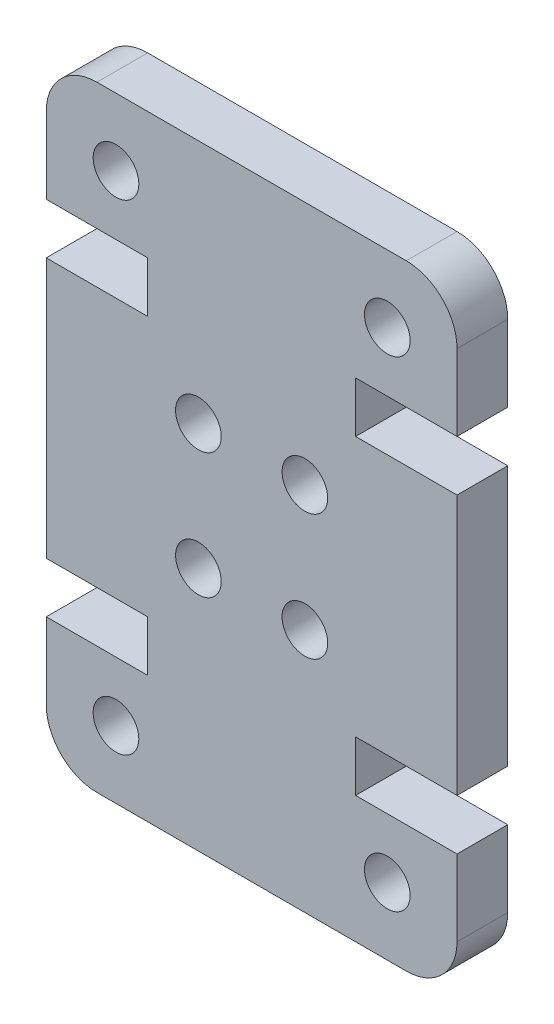
from build123d import *

# Parameters (mm, degrees)
SKETCH1_R           = 0.9
BOSS_EXTRUDE1_DEPTH = 2


with BuildPart() as part:
    # Sketch1 → Boss-Extrude1 (new body)
    with BuildSketch(Plane.XY):
        with BuildLine():
            Line((16.2, 17.26), (16.2, 7))
            Line((16.2, 7), (12.2, 7))
            Line((12.2, 7), (12.2, 5))
            Line((12.2, 5), (16.2, 5))
            Line((16.2, 5), (16.2, 2))
            ThreePointArc((16.2, 2), (15.614213562, 0.585786438), (14.2, 0))
            Line((14.2, 0), (2, 0))
            ThreePointArc((2, 0), (0.585786438, 0.585786438), (0, 2))
            Line((0, 2), (0, 5))
            Line((0, 5), (4, 5))
            Line((4, 5), (4, 7))
            Line((4, 7), (0, 7))
            Line((0, 7), (0, 17.26))
            Line((0, 17.26), (4, 17.26))
            Line((4, 17.26), (4, 19.26))
            Line((4, 19.26), (0, 19.26))
            Line((0, 19.26), (0, 22.26))
            ThreePointArc((0, 22.26), (0.585786438, 23.674213562), (2, 24.26))
            Line((2, 24.26), (14.2, 24.26))
            ThreePointArc((14.2, 24.26), (15.614213562, 23.674213562), (16.2, 22.26))
            Line((16.2, 22.26), (16.2, 19.26))
            Line((16.2, 19.26), (12.2, 19.26))
            Line((12.2, 19.26), (12.2, 17.26))
            Line((12.2, 17.26), (16.2, 17.26))
        make_face()
        with Locations(Location((13.45, 2.653551169, 0), (0, 0, 180))):
            Circle(SKETCH1_R, mode=Mode.SUBTRACT)
        with Locations(Location((10.2, 9.653551169, 0), (0, 0, 180))):
            Circle(SKETCH1_R, mode=Mode.SUBTRACT)
        with Locations(Location((2.75, 21.606448831, 0), (0, 0, 180))):
            Circle(SKETCH1_R, mode=Mode.SUBTRACT)
        with Locations(Location((6, 14.606448831, 0), (0, 0, 180))):
            Circle(SKETCH1_R, mode=Mode.SUBTRACT)
        with Locations((10.2, 14.606448831)):
            Circle(SKETCH1_R, mode=Mode.SUBTRACT)
        with Locations((13.45, 21.606448831)):
            Circle(SKETCH1_R, mode=Mode.SUBTRACT)
        with Locations((6, 9.653551169)):
            Circle(SKETCH1_R, mode=Mode.SUBTRACT)
        with Locations((2.75, 2.653551169)):
            Circle(SKETCH1_R, mode=Mode.SUBTRACT)
    extrude(amount=BOSS_EXTRUDE1_DEPTH)


solid = part.part
